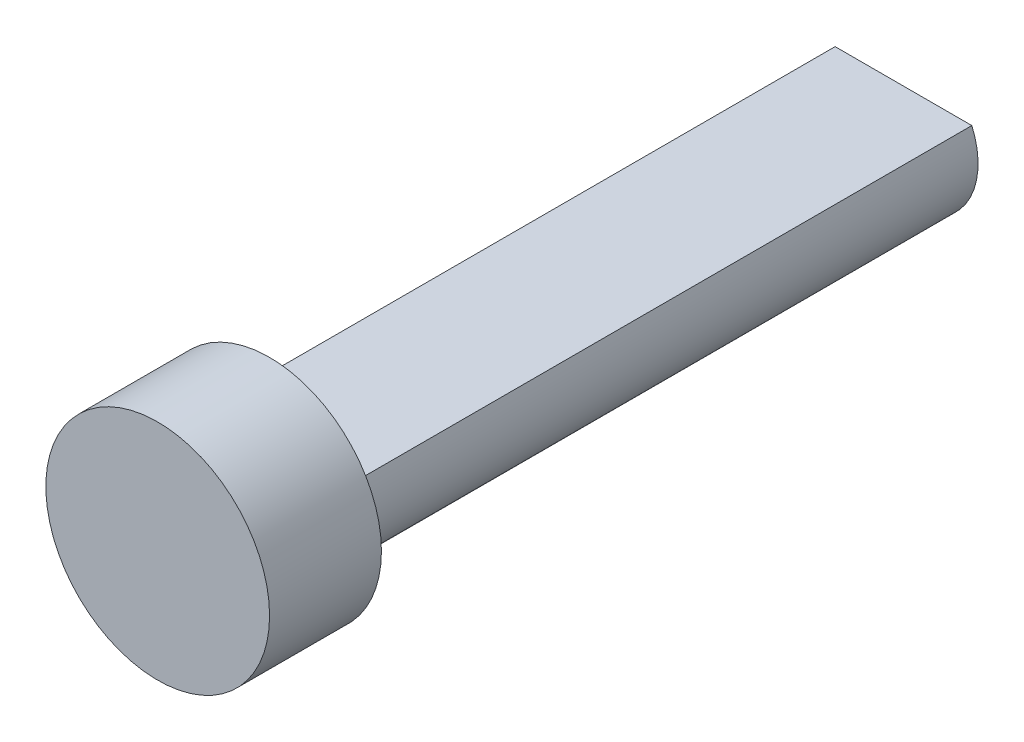
from build123d import *

# Parameters (mm, degrees)
BOSS_EXTRUDE1_DEPTH = 20
SKETCH2_R           = 3
BOSS_EXTRUDE2_DEPTH = 3


with BuildPart() as part:
    # Sketch1 → Boss-Extrude1 (new body)
    with BuildSketch(Plane.XY):
        with BuildLine():
            Line((-1.833030278, 0.8), (1.833030278, 0.8))
            ThreePointArc((1.833030278, 0.8), (0, -2), (-1.833030278, 0.8))
        make_face()
    extrude(amount=BOSS_EXTRUDE1_DEPTH)

    # Sketch2 → Boss-Extrude2 (add)
    with BuildSketch(Plane.XY.offset(20)):
        Circle(SKETCH2_R)
    extrude(amount=-BOSS_EXTRUDE2_DEPTH)


solid = part.part
